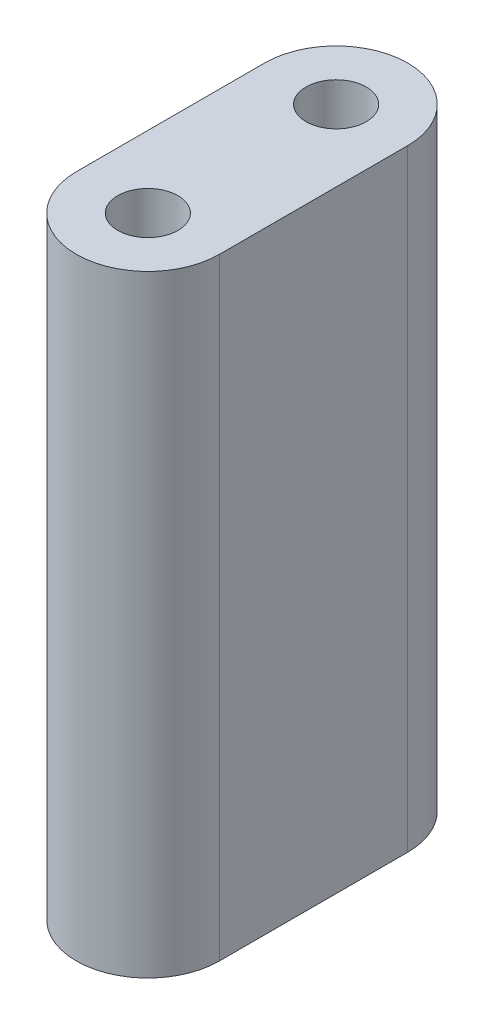
from build123d import *

# Parameters (mm, degrees)
BOSS_EXTRUDE1_DEPTH = 32.5
SKETCH2_R           = 1.6
CUT_EXTRUDE1_DEPTH  = 34.884067052


with BuildPart() as part:
    # Sketch1 → Boss-Extrude1 (new body)
    with BuildSketch(Plane(origin=(0, 0, 0), x_dir=(1, 0, 0), z_dir=(0, 1, 0))):
        with BuildLine():
            Line((-3.8, -5), (-3.8, 5))
            ThreePointArc((-3.8, 5), (0, 8.8), (3.8, 5))
            Line((3.8, 5), (3.8, -5))
            ThreePointArc((3.8, -5), (0, -8.8), (-3.8, -5))
        make_face()
    extrude(amount=BOSS_EXTRUDE1_DEPTH)

    # Sketch2 → Cut-Extrude1 (cut, through all)
    with BuildSketch(Plane(origin=(0, 32.5, 0), x_dir=(1, 0, 0), z_dir=(0, 1, 0))):
        with Locations(Location((0, 5, 0), (0, 0, 270))):
            Circle(SKETCH2_R)
        with Locations(Location((0, -5, 0), (0, 0, 270))):
            Circle(SKETCH2_R)
    extrude(amount=-CUT_EXTRUDE1_DEPTH, mode=Mode.SUBTRACT)


solid = part.part
